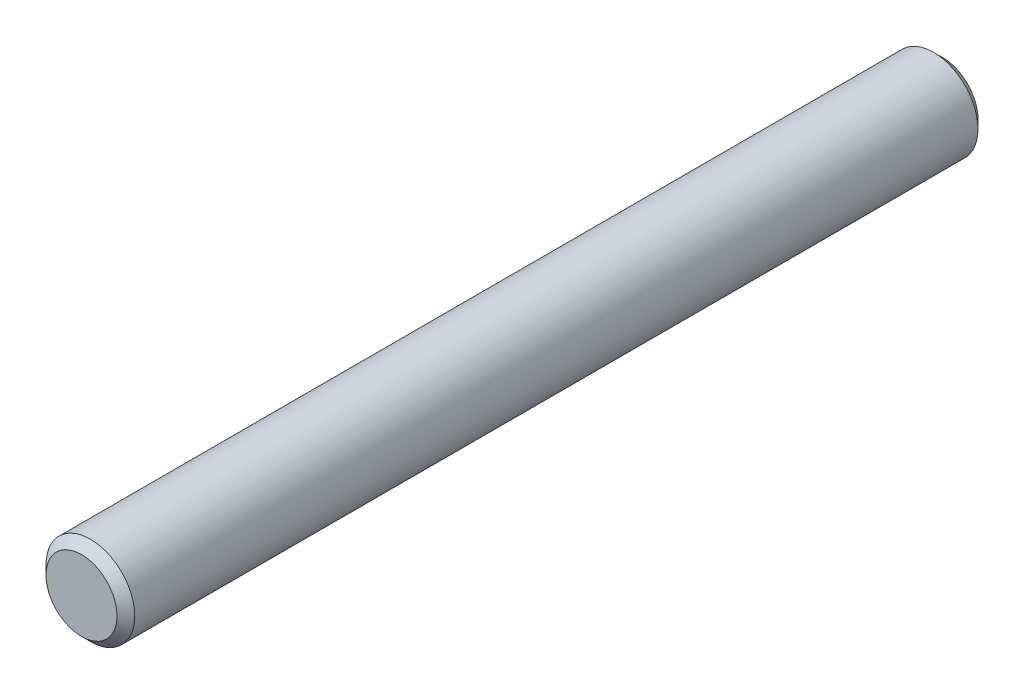
from build123d import *

# Parameters (mm, degrees)
SKETCH1_W     = 9.7
SKETCH1_H     = 0.5
CHAMFER1_SIZE = 0.1


with BuildPart() as part:
    # Sketch1 → Revolve1 (revolve)
    with BuildSketch(Plane(origin=(0, 0, 0), x_dir=(0, 0, -1), z_dir=(1, 0, 0)), mode=Mode.PRIVATE) as revolve1_sk:
        with Locations((4.85, 0.25)):
            Rectangle(SKETCH1_W, SKETCH1_H)
    revolve(revolve1_sk.sketch.rotate(Axis((0, 0, 5.654205607), (0, 0, -1)), 90), axis=Axis((0, 0, 5.654205607), (0, 0, -1)))

    # Chamfer1
    chamfer1_edges = [part.edges().sort_by_distance(p)[0] for p in [
        (-0.5, 0, -9.7),
        (-0.5, 0, 0),
    ]]
    chamfer(chamfer1_edges, length=CHAMFER1_SIZE)


solid = part.part
